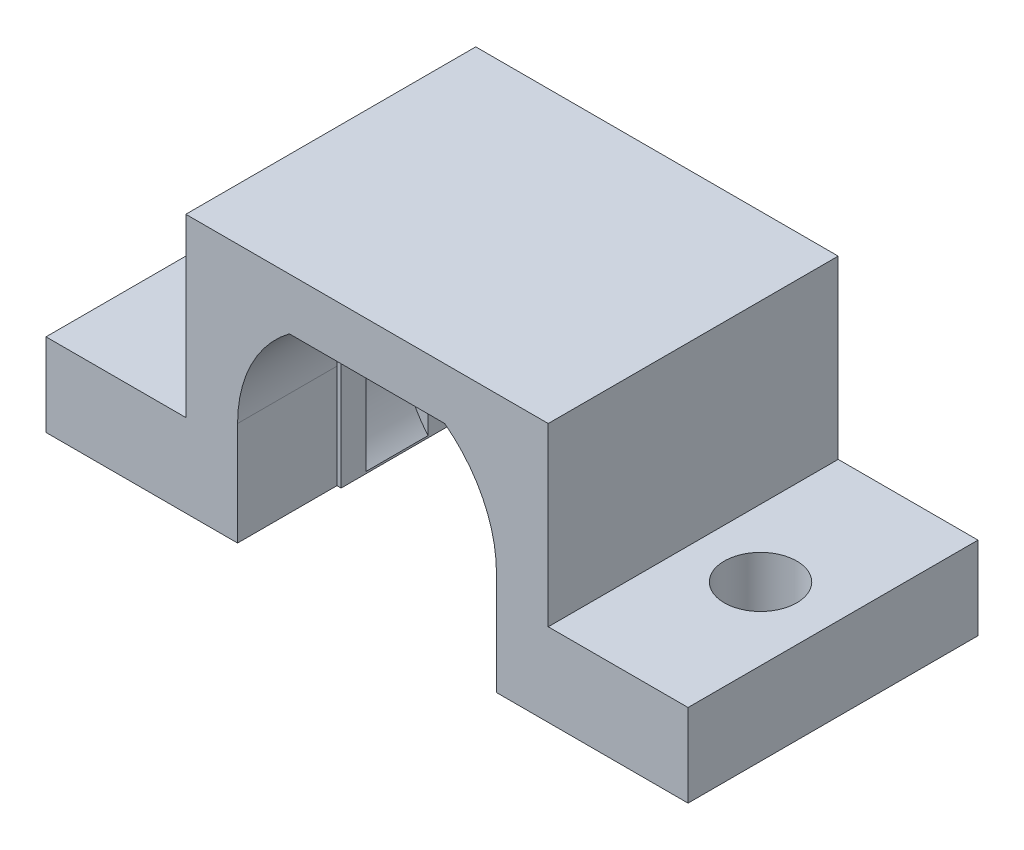
from build123d import *

# Parameters (mm, degrees)
BOSS_EXTRU_1_DEPTH      = 7
ENL_V_MAT_EXTRU_1_DEPTH = 1.5
ESQUISSE3_R             = 1.75
ENL_V_MAT_EXTRU_2_DEPTH = 8.5
ESQUISSE4_W             = 12.5
ESQUISSE4_H             = 5
ENL_V_MAT_EXTRU_3_DEPTH = 9.2
BOSS_EXTRU_2_START      = 1.2
BOSS_EXTRU_2_DEPTH      = 1.8
BOSS_EXTRU_3_REACH      = 23.107
ESQUISSE8_W             = 0.2
ESQUISSE8_H             = 9.2
ESQUISSE6_R             = 4.379651067
ENL_V_MAT_EXTRU_4_DEPTH = 3
ENL_V_START             = 1
ESQUISSE7_R             = 4.166394869
ENL_V_MAT_EXTRU_5_DEPTH = 2
BOSS_EXTRU_4_START      = 1.5
ESQUISSE9_R             = 1.75
BOSS_EXTRU_4_DEPTH      = 1.5


with BuildPart() as part:
    # Esquisse1 → Boss.-Extru.1 (new, symmetric)
    with BuildSketch(Plane.XY):
        with BuildLine():
            Line((-15.5, 0), (-6.25, 0))
            Line((-6.25, 0), (-6.25, 5))
            ThreePointArc((-6.25, 5), (-5.590169944, 7.795084972), (-3.75, 10))
            Line((-3.75, 10), (3.75, 10))
            ThreePointArc((3.75, 10), (5.590169944, 7.795084972), (6.25, 5))
            Line((6.25, 5), (6.25, 0))
            Line((6.25, 0), (15.5, 0))
            Line((15.5, 0), (15.5, 4))
            Line((15.5, 4), (8.75, 4))
            Line((8.75, 4), (8.75, 12.5))
            Line((8.75, 12.5), (-8.75, 12.5))
            Line((-8.75, 12.5), (-8.75, 4))
            Line((-8.75, 4), (-15.5, 4))
            Line((-15.5, 4), (-15.5, 0))
        make_face()
    extrude(amount=BOSS_EXTRU_1_DEPTH, both=True)

    # Esquisse2 → Enlèv. mat.-Extru.1 (cut)
    with BuildSketch(Plane(origin=(0, 4, 0), x_dir=(1, 0, 0), z_dir=(0, 1, 0))):
        Polygon((-9.1, -1.674315781), (-9.1, 1.674315781), (-12, 3.348631561), (-14.9, 1.674315781), (-14.9, -1.674315781), (-12, -3.348631561), align=None)
        Polygon((9.1, -1.674315781), (12, -3.348631561), (14.9, -1.674315781), (14.9, 1.674315781), (12, 3.348631561), (9.1, 1.674315781), align=None)
    extrude(amount=-ENL_V_MAT_EXTRU_1_DEPTH, mode=Mode.SUBTRACT)

    # Esquisse3 → Enlèv. mat.-Extru.2 (cut)
    with BuildSketch(Plane(origin=(0, 2.5, 0), x_dir=(1, 0, 0), z_dir=(0, 1, 0))):
        with Locations(Location((-12, 0, 0), (0, 0, 270))):
            Circle(ESQUISSE3_R)
        with Locations(Location((12, 0, 0), (0, 0, 270))):
            Circle(ESQUISSE3_R)
    extrude(amount=-ENL_V_MAT_EXTRU_2_DEPTH, mode=Mode.SUBTRACT)

    # Esquisse4 → Enlèv. mat.-Extru.3 (cut)
    with BuildSketch(Plane(origin=(0, 0, -7), x_dir=(-1, 0, 0), z_dir=(0, 0, -1))):
        with Locations((0, 7.5)):
            Rectangle(ESQUISSE4_W, ESQUISSE4_H)
    extrude(amount=-ENL_V_MAT_EXTRU_3_DEPTH, mode=Mode.SUBTRACT)

    # Esquisse5 → Boss.-Extru.2 (add)
    with BuildSketch(Plane(origin=(0, 0, 2.2), x_dir=(-1, 0, 0), z_dir=(0, 0, -1)).offset(BOSS_EXTRU_2_START)):
        Polygon((-3.75, 10), (-6.25, 5), (-6.25, 10), align=None)
    extrude(amount=BOSS_EXTRU_2_DEPTH)

    # Boss.-Extru.3: up to this face of the body (flat: up to its plane)
    boss_extru_3_end = Plane(part.part.faces().sort_by_distance((-0.153583618, 10, -0.75665529))[0])
    # Esquisse8 → Boss.-Extru.3 (add, up to the picked face)
    with BuildSketch(Plane.XZ, mode=Mode.PRIVATE) as boss_extru_3_sk1:
        with Locations((6.15, -2.4)):
            Rectangle(ESQUISSE8_W, ESQUISSE8_H)
    boss_extru_3_tool1 = split(extrude(boss_extru_3_sk1.sketch, amount=-BOSS_EXTRU_3_REACH, mode=Mode.PRIVATE), bisect_by=boss_extru_3_end, keep=Keep.BOTH, mode=Mode.PRIVATE)
    # Esquisse8 → Boss.-Extru.3 (add, up to the picked face)
    with BuildSketch(Plane.XZ, mode=Mode.PRIVATE) as boss_extru_3_sk2:
        with Locations((-6.15, -2.4)):
            Rectangle(ESQUISSE8_W, ESQUISSE8_H)
    boss_extru_3_tool2 = split(extrude(boss_extru_3_sk2.sketch, amount=-BOSS_EXTRU_3_REACH, mode=Mode.PRIVATE), bisect_by=boss_extru_3_end, keep=Keep.BOTH, mode=Mode.PRIVATE)
    add(boss_extru_3_tool1.solids().sort_by(Axis((6.15, 0, -2.4), (0, 1, 0)))[0])
    add(boss_extru_3_tool2.solids().sort_by(Axis((-6.15, 0, -2.4), (0, 1, 0)))[0])

    # Esquisse6 → Enlèv. mat.-Extru.4 (cut)
    with BuildSketch(Plane.XY.offset(1)):
        with Locations((-2.786650878, 3.015494516)):
            Circle(ESQUISSE6_R)
    extrude(amount=-ENL_V_MAT_EXTRU_4_DEPTH, mode=Mode.SUBTRACT)

    # Esquisse7 → Enlèv. mat.-Extru.5 (cut)
    with BuildSketch(Plane(origin=(0, 0, -0.8), x_dir=(-1, 0, 0), z_dir=(0, 0, -1)).offset(ENL_V_START)):
        with Locations((-3.11839503, 6.498808114)):
            Circle(ESQUISSE7_R)
    extrude(amount=ENL_V_MAT_EXTRU_5_DEPTH, mode=Mode.SUBTRACT)

    # Esquisse9 → Boss.-Extru.4 (add)
    # profile 1 of 2: a face of its own
    with BuildSketch(Plane(origin=(0, 2.5, 0), x_dir=(1, 0, 0), z_dir=(0, 1, 0)).offset(BOSS_EXTRU_4_START)):
        Polygon((9.1, 1.674315781), (9.1, -1.674315781), (12, -3.348631561), (14.9, -1.674315781), (14.9, 1.674315781), (12, 3.348631561), align=None)
        with Locations(Location((12, 0, 0), (0, 0, 270))):
            Circle(ESQUISSE9_R, mode=Mode.SUBTRACT)
    # profile 2 of 2: a face of its own
    with BuildSketch(Plane(origin=(0, 2.5, 0), x_dir=(1, 0, 0), z_dir=(0, 1, 0)).offset(BOSS_EXTRU_4_START)):
        Polygon((-12, -3.348631561), (-9.1, -1.674315781), (-9.1, 1.674315781), (-12, 3.348631561), (-14.9, 1.674315781), (-14.9, -1.674315781), align=None)
        with Locations(Location((-12, 0, 0), (0, 0, 270))):
            Circle(ESQUISSE9_R, mode=Mode.SUBTRACT)
    extrude(amount=-BOSS_EXTRU_4_DEPTH)


solid = part.part
